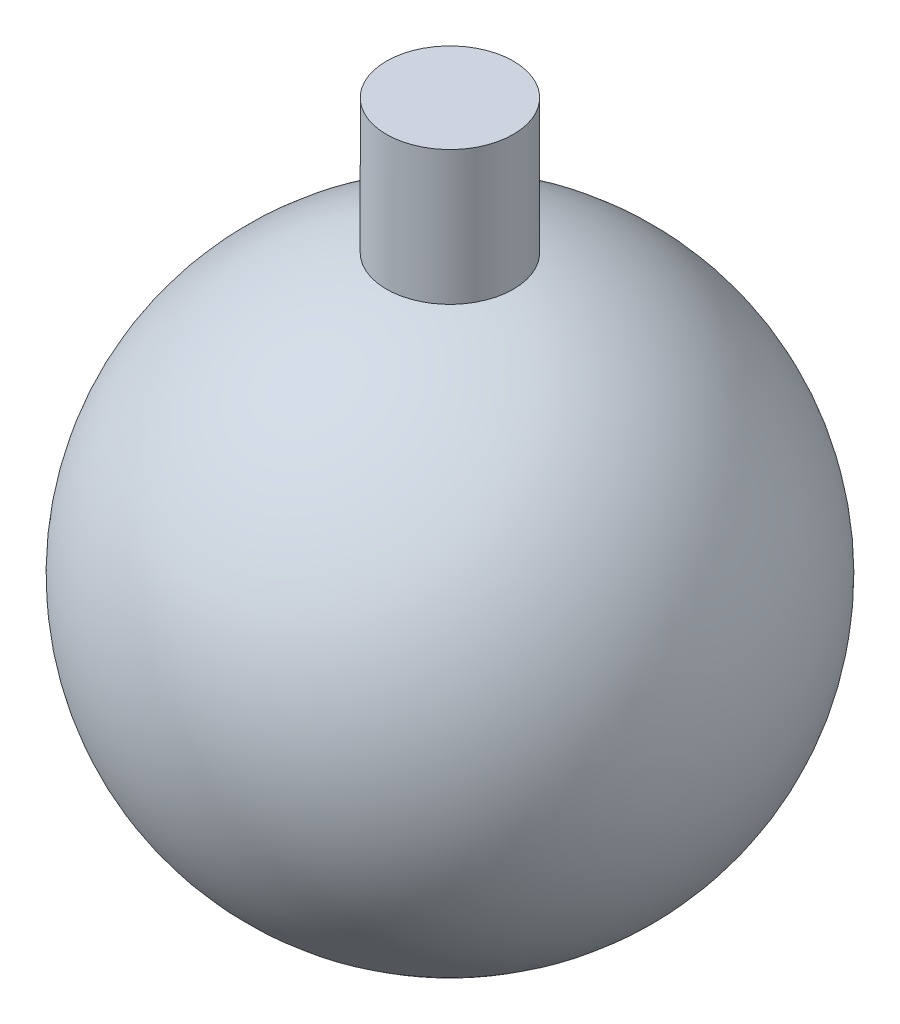
from build123d import *

# Parameters (mm, degrees)
SKETCH3_R           = 2
BOSS_EXTRUDE1_DEPTH = 13


with BuildPart() as part:
    # Sketch1 → Revolve3 (revolve)
    with BuildSketch(Plane.XY):
        with BuildLine():
            Line((0, 9), (0, -9))
            ThreePointArc((0, -9), (-9, 0), (0, 9))
        make_face()
    revolve(axis=Axis((0, 9, 0), (0, -1, 0)))

    # Sketch3 → Boss-Extrude1 (add)
    with BuildSketch(Plane(origin=(0, 0, 0), x_dir=(1, 0, 0), z_dir=(0, 1, 0))):
        Circle(SKETCH3_R)
    extrude(amount=BOSS_EXTRUDE1_DEPTH)


solid = part.part
